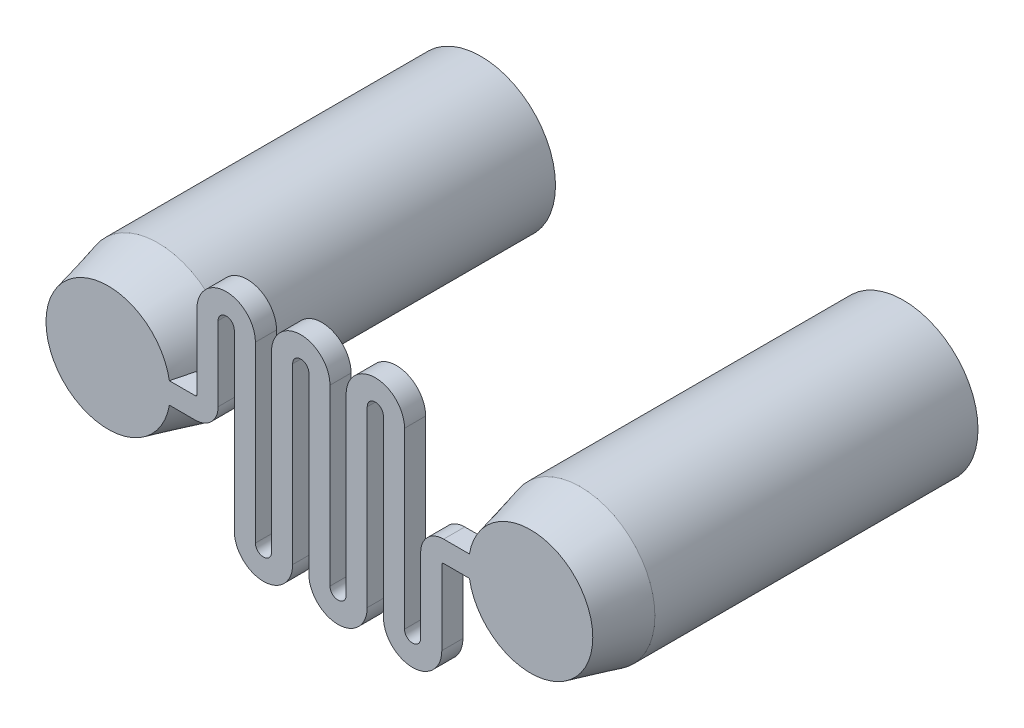
from build123d import *

# Parameters (mm, degrees)
BOSS_EXTRUDE1_DEPTH = 1.7
SKETCH5_R           = 5
CUT_EXTRUDE1_DEPTH  = 28


with BuildPart() as part:
    # Sketch2 → Boss-Extrude1 (new body)
    with BuildSketch(Plane.XY):
        with BuildLine():
            Line((-20.5, -0.85), (-13.5, -0.85))
            ThreePointArc((-13.5, -0.85), (-12.191852455, -0.308147545), (-11.65, 1))
            Line((-11.65, 1), (-11.65, 7))
            ThreePointArc((-11.65, 7), (-11, 7.65), (-10.35, 7))
            Line((-10.35, 7), (-10.35, 0))
            Line((-10.35, 0), (-10.35, -7))
            ThreePointArc((-10.35, -7), (-8, -9.35), (-5.65, -7))
            Line((-5.65, -7), (-5.65, 0))
            Line((-5.65, 0), (-5.65, 7))
            ThreePointArc((-5.65, 7), (-5, 7.65), (-4.35, 7))
            Line((-4.35, 7), (-4.35, 0))
            Line((-4.35, 0), (-4.35, -7))
            ThreePointArc((-4.35, -7), (-2, -9.35), (0.35, -7))
            Line((0.35, -7), (0.35, 0))
            Line((0.35, 0), (0.35, 7))
            ThreePointArc((0.35, 7), (1, 7.65), (1.65, 7))
            Line((1.65, 7), (1.65, 0))
            Line((1.65, 0), (1.65, -7))
            ThreePointArc((1.65, -7), (4, -9.35), (6.35, -7))
            Line((6.35, -7), (6.35, -1))
            ThreePointArc((6.35, -1), (6.393933983, -0.893933983), (6.5, -0.85))
            Line((6.5, -0.85), (13.5, -0.85))
            ThreePointArc((13.5, -0.85), (14.35, 0), (13.5, 0.85))
            Line((13.5, 0.85), (6.5, 0.85))
            ThreePointArc((6.5, 0.85), (5.191852455, 0.308147545), (4.65, -1))
            Line((4.65, -1), (4.65, -7))
            ThreePointArc((4.65, -7), (4, -7.65), (3.35, -7))
            Line((3.35, -7), (3.35, 0))
            Line((3.35, 0), (3.35, 7))
            ThreePointArc((3.35, 7), (1, 9.35), (-1.35, 7))
            Line((-1.35, 7), (-1.35, 0))
            Line((-1.35, 0), (-1.35, -7))
            ThreePointArc((-1.35, -7), (-2, -7.65), (-2.65, -7))
            Line((-2.65, -7), (-2.65, 0))
            Line((-2.65, 0), (-2.65, 7))
            ThreePointArc((-2.65, 7), (-5, 9.35), (-7.35, 7))
            Line((-7.35, 7), (-7.35, 0))
            Line((-7.35, 0), (-7.35, -7))
            ThreePointArc((-7.35, -7), (-8, -7.65), (-8.65, -7))
            Line((-8.65, -7), (-8.65, 0))
            Line((-8.65, 0), (-8.65, 7))
            ThreePointArc((-8.65, 7), (-11, 9.35), (-13.35, 7))
            Line((-13.35, 7), (-13.35, 1))
            ThreePointArc((-13.35, 1), (-13.393933983, 0.893933983), (-13.5, 0.85))
            Line((-13.5, 0.85), (-20.5, 0.85))
            ThreePointArc((-20.5, 0.85), (-21.35, 0), (-20.5, -0.85))
        make_face()
    extrude(amount=BOSS_EXTRUDE1_DEPTH)

    # Sketch3 → Revolve1 (revolve)
    with BuildSketch(Plane(origin=(0, 0, 0), x_dir=(1, 0, 0), z_dir=(0, 1, 0)), mode=Mode.PRIVATE) as revolve1_sk:
        Polygon((-20.5, -1.7), (-25.5, -1.7), (-26.5, 2.3), (-26.5, 28.3), (-20.5, 28.3), align=None)
    revolve(revolve1_sk.sketch.rotate(Axis((-20.5, 0, 1.7), (0, 0, -1)), 189.787819359), axis=Axis((-20.5, 0, 1.7), (0, 0, -1)))

    # Sketch4 → Revolve2 (revolve)
    with BuildSketch(Plane(origin=(0, 0, 0), x_dir=(1, 0, 0), z_dir=(0, 1, 0)), mode=Mode.PRIVATE) as revolve2_sk:
        Polygon((13.5, -1.7), (18.5, -1.7), (19.5, 2.3), (19.5, 28.3), (13.5, 28.3), align=None)
    revolve(revolve2_sk.sketch.rotate(Axis((13.5, 0, 1.7), (0, 0, -1)), 170.985639202), axis=Axis((13.5, 0, 1.7), (0, 0, -1)))

    # Sketch5 → Cut-Extrude1 (cut)
    with BuildSketch(Plane(origin=(0, 0, -28.3), x_dir=(-1, 0, 0), z_dir=(0, 0, -1))):
        with Locations((-13.5, 0)):
            Circle(SKETCH5_R)
        with Locations((20.5, 0)):
            Circle(SKETCH5_R)
    extrude(amount=-CUT_EXTRUDE1_DEPTH, mode=Mode.SUBTRACT)


solid = part.part
